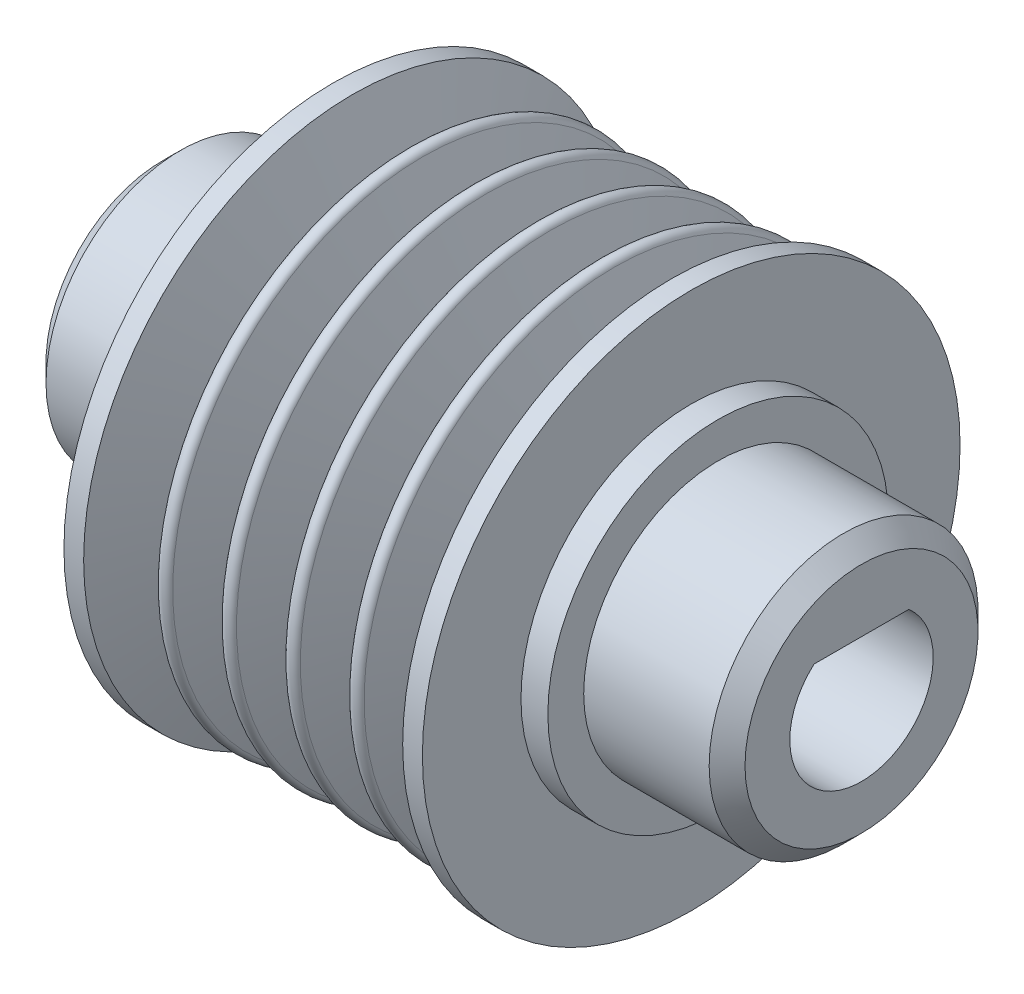
from build123d import *

# Parameters (mm, degrees)
SKETCH_1_W               = 20
SKETCH_1_H               = 15
CUT_EXTRUDE_1_DEPTH      = 29.814059068
CUT_EXTRUDE_1_DEPTH_BACK = 29.814059068
SKETCH_5_R               = 4
EXTRUDE_START            = -39
EXTRUDE_1_DEPTH          = 39
FILLET_1_R               = 0.4
CHAMFER_1_SIZE           = 1
FILLET_2_R               = 0.4


with BuildPart() as part:
    # Эскиз1 → Повернуть1 (revolve)
    with BuildSketch(Plane.XY, mode=Mode.PRIVATE) as revolve_1_sk:
        with Locations((0, 7.5)):
            Rectangle(SKETCH_1_W, SKETCH_1_H)
    revolve(revolve_1_sk.sketch.rotate(Axis((-17.215553937, 0, 0), (1, 0, 0)), 90), axis=Axis((-17.215553937, 0, 0), (1, 0, 0)))

    # Эскиз3 → Повернуть2 (revolve)
    with BuildSketch(Plane.XY, mode=Mode.PRIVATE) as revolve_2_sk:
        Polygon((-11.5, 7.5), (-19.5, 7.5), (-19.5, 0), (-10, 0), (-10, 9.5), (-11.5, 9.5), align=None)
        Polygon((11.5, 7.5), (19.5, 7.5), (19.5, 0), (10, 0), (10, 9.5), (11.5, 9.5), align=None)
    revolve(revolve_2_sk.sketch.rotate(Axis((0, 0, 0), (1, 0, 0)), 90), axis=Axis((0, 0, 0), (1, 0, 0)))

    # Эскиз8 → Вырез-Повернуть2 (revolve, cut)
    with BuildSketch(Plane.XY):
        Polygon((-7.12, 10.109490193), (-5.34, 15), (-8.9, 15), align=None)
        Polygon((-1.78, 15), (-5.34, 15), (-3.56, 10.109490193), align=None)
        Polygon((1.78, 15), (-1.78, 15), (0, 10.109490193), align=None)
        Polygon((8.9, 15), (5.34, 15), (7.12, 10.109490193), align=None)
        Polygon((5.34, 15), (1.78, 15), (3.56, 10.109490193), align=None)
    revolve(axis=Axis((0, 0, 0), (-1, 0, 0)), mode=Mode.SUBTRACT)

    # Эскиз5 → Вырез-Вытянуть1 (cut, two sides: drawn at the far end of the back side and taken through both)
    with BuildSketch(Plane(origin=(0, 0, 0), x_dir=(0, 0, -1), z_dir=(1, 0, 0)).offset(-CUT_EXTRUDE_1_DEPTH_BACK)):
        Circle(SKETCH_5_R)
    extrude(amount=CUT_EXTRUDE_1_DEPTH + CUT_EXTRUDE_1_DEPTH_BACK, mode=Mode.SUBTRACT)

    # Эскиз7 → Бобышка-Вытянуть1 (add)
    with BuildSketch(Plane.ZY.offset(19.5).offset(EXTRUDE_START)):
        with BuildLine():
            Line((-2.645751311, 3), (2.645751311, 3))
            ThreePointArc((2.645751311, 3), (0, 4), (-2.645751311, 3))
        make_face()
    extrude(amount=EXTRUDE_1_DEPTH)

    # Скругление1
    fillet_1_edges = [part.edges().sort_by_distance(p)[0] for p in [
        (-5.34, -15, 0),
        (-1.78, -15, 0),
        (1.78, -15, 0),
        (5.34, -15, 0),
    ]]
    fillet(fillet_1_edges, radius=FILLET_1_R)

    # Фаска1
    chamfer_1_edges = [part.edges().sort_by_distance(p)[0] for p in [
        (19.5, 0, -7.5),
        (-19.5, 0, -7.5),
    ]]
    chamfer(chamfer_1_edges, length=CHAMFER_1_SIZE)

    # Скругление2
    fillet_2_edges = [part.edges().sort_by_distance(p)[0] for p in [
        (-7.12, -10.109490193, 0),
        (0, -10.109490193, 0),
        (7.12, -10.109490193, 0),
        (-3.56, -10.109490193, 0),
        (3.56, -10.109490193, 0),
    ]]
    fillet(fillet_2_edges, radius=FILLET_2_R)


solid = part.part
